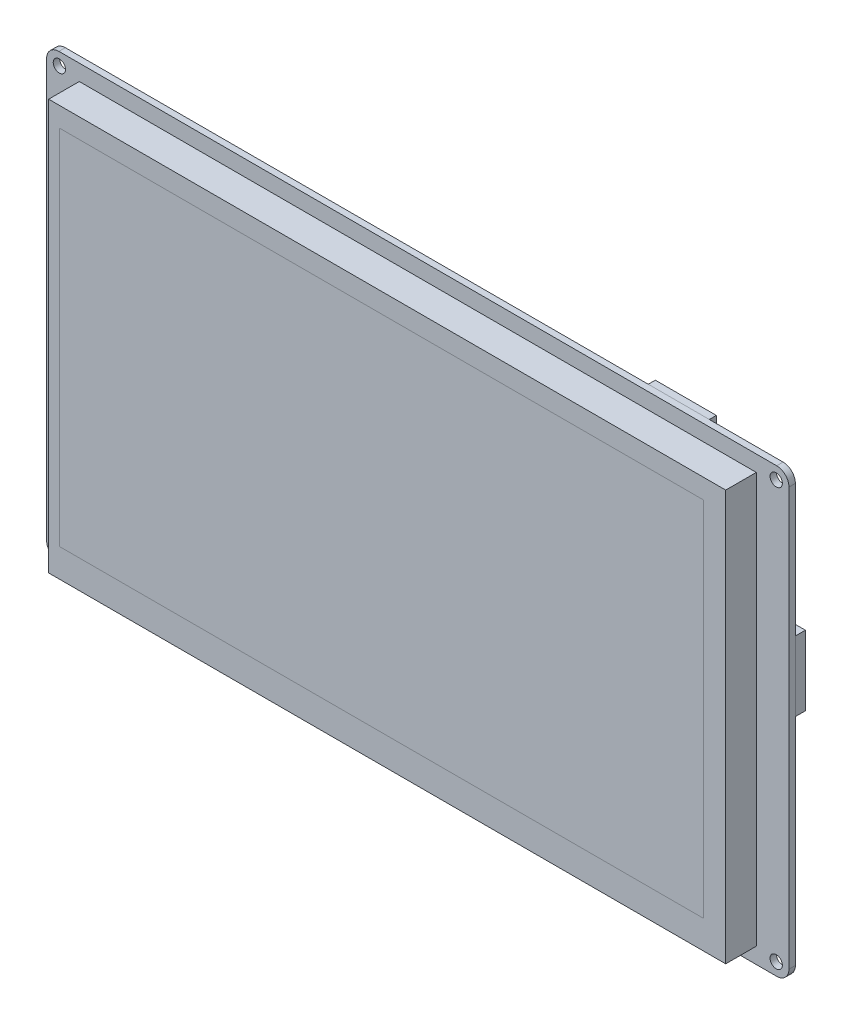
from build123d import *

# Parameters (mm, degrees)
SKETCH1_W           = 180.92
SKETCH1_H           = 107.76
SKETCH1_R           = 1.5
BOSS_EXTRUDE1_DEPTH = 1.56
SKETCH2_W           = 165
SKETCH2_H           = 100
BOSS_EXTRUDE2_DEPTH = 7.46
SKETCH3_W           = 7.8
SKETCH3_H           = 14.88
BOSS_EXTRUDE3_DEPTH = 5.96
SKETCH4_W           = 14.87
SKETCH4_H           = 14.9
BOSS_EXTRUDE4_DEPTH = 1.72
SKETCH5_W           = 5.46
SKETCH5_H           = 17.02
BOSS_EXTRUDE5_DEPTH = 2.44
SKETCH6_W           = 113.02
SKETCH6_H           = 3
CUT_EXTRUDE1_DEPTH  = 1.56
FILLET1_R           = 3


with BuildPart() as part:
    # Sketch1 → Boss-Extrude1 (new body)
    with BuildSketch(Plane.XY):
        Rectangle(SKETCH1_W, SKETCH1_H)
        with Locations(Location((87.35, 50.85, 0), (0, 0, 180))):
            Circle(SKETCH1_R, mode=Mode.SUBTRACT)
        with Locations(Location((87.35, -50.85, 0), (0, 0, 180))):
            Circle(SKETCH1_R, mode=Mode.SUBTRACT)
        with Locations(Location((-87.35, 50.85, 0), (0, 0, 180))):
            Circle(SKETCH1_R, mode=Mode.SUBTRACT)
        with Locations(Location((-87.35, -50.85, 0), (0, 0, 180))):
            Circle(SKETCH1_R, mode=Mode.SUBTRACT)
    extrude(amount=BOSS_EXTRUDE1_DEPTH)

    # Sketch6 → Cut-Extrude1 (cut)
    with BuildSketch(Plane(origin=(0, 0, 0), x_dir=(-1, 0, 0), z_dir=(0, 0, -1))):
        with Locations((-5.47, -48.04)):
            Rectangle(SKETCH6_W, SKETCH6_H)
    extrude(amount=-CUT_EXTRUDE1_DEPTH, mode=Mode.SUBTRACT)

    # Fillet1
    fillet1_edges = [part.edges().sort_by_distance(p)[0] for p in [
        (90.46, -53.88, 0.78),
        (-90.46, -53.88, 0.78),
        (-90.46, 53.88, 0.78),
        (90.46, 53.88, 0.78),
    ]]
    fillet(fillet1_edges, radius=FILLET1_R)


with BuildPart() as body_2:
    # Sketch2 → Boss-Extrude2 (new body)
    with BuildSketch(Plane.XY.offset(1.56)):
        Rectangle(SKETCH2_W, SKETCH2_H)
    extrude(amount=BOSS_EXTRUDE2_DEPTH)


with BuildPart() as body_3:
    # Sketch3 → Boss-Extrude3 (new body)
    with BuildSketch(Plane(origin=(0, 0, 0), x_dir=(-1, 0, 0), z_dir=(0, 0, -1))):
        with Locations((86.56, 0)):
            Rectangle(SKETCH3_W, SKETCH3_H)
    extrude(amount=BOSS_EXTRUDE3_DEPTH)


with BuildPart() as body_4:
    # Sketch4 → Boss-Extrude4 (new body)
    with BuildSketch(Plane(origin=(0, 0, 0), x_dir=(-1, 0, 0), z_dir=(0, 0, -1))):
        with Locations((-62.045, 46.43)):
            Rectangle(SKETCH4_W, SKETCH4_H)
    extrude(amount=BOSS_EXTRUDE4_DEPTH)


with BuildPart() as body_5:
    # Sketch5 → Boss-Extrude5 (new body)
    with BuildSketch(Plane(origin=(0, 0, 0), x_dir=(-1, 0, 0), z_dir=(0, 0, -1))):
        with Locations((-87.73, 10.17)):
            Rectangle(SKETCH5_W, SKETCH5_H)
    extrude(amount=BOSS_EXTRUDE5_DEPTH)


solid = Compound([part.part, body_2.part, body_3.part, body_4.part, body_5.part])
